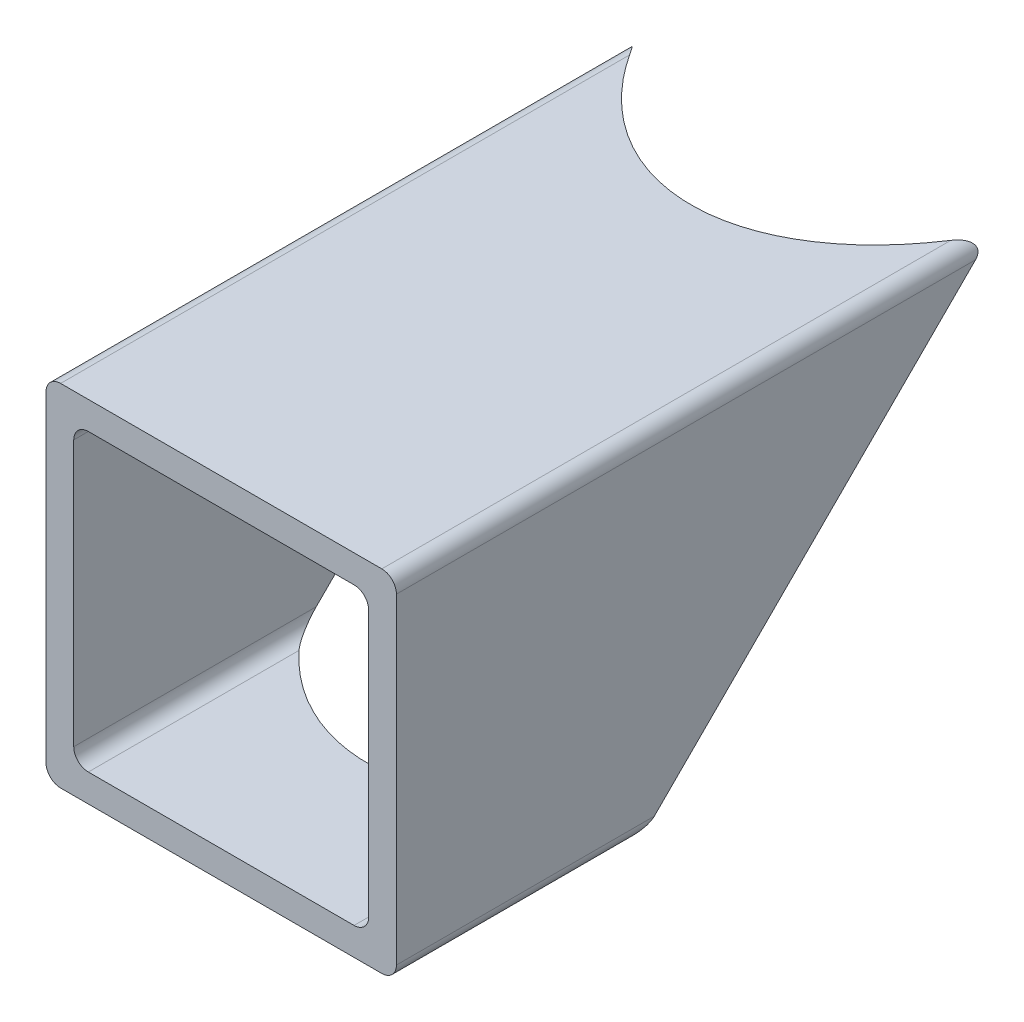
from build123d import *

# Parameters (mm, degrees)
BOSS_EXTRUDE1_DEPTH = 50.8
SKETCH3_R           = 19.05
CUT_EXTRUDE1_DEPTH  = 65.557986338


with BuildPart() as part:
    # Sketch2 → Boss-Extrude1 (new body)
    with BuildSketch(Plane.XY):
        with BuildLine():
            Line((-13.97, -15.24), (13.97, -15.24))
            ThreePointArc((13.97, -15.24), (14.868025612, -14.868025612), (15.24, -13.97))
            Line((15.24, -13.97), (15.24, 13.97))
            ThreePointArc((15.24, 13.97), (14.868025612, 14.868025612), (13.97, 15.24))
            Line((13.97, 15.24), (-13.97, 15.24))
            ThreePointArc((-13.97, 15.24), (-14.868025612, 14.868025612), (-15.24, 13.97))
            Line((-15.24, 13.97), (-15.24, -13.97))
            ThreePointArc((-15.24, -13.97), (-14.868025612, -14.868025612), (-13.97, -15.24))
        make_face()
        with BuildLine():
            Line((-11.557, -12.827), (11.557, -12.827))
            ThreePointArc((11.557, -12.827), (12.455025612, -12.455025612), (12.827, -11.557))
            Line((12.827, -11.557), (12.827, 11.557))
            ThreePointArc((12.827, 11.557), (12.455025612, 12.455025612), (11.557, 12.827))
            Line((11.557, 12.827), (-11.557, 12.827))
            ThreePointArc((-11.557, 12.827), (-12.455025612, 12.455025612), (-12.827, 11.557))
            Line((-12.827, 11.557), (-12.827, -11.557))
            ThreePointArc((-12.827, -11.557), (-12.455025612, -12.455025612), (-11.557, -12.827))
        make_face(mode=Mode.SUBTRACT)
    extrude(amount=BOSS_EXTRUDE1_DEPTH)

    # Sketch3 → Cut-Extrude1 (cut, through all)
    with BuildSketch(Plane(origin=(0, 7.62, -7.62), x_dir=(-1, 0, 0), z_dir=(0, 0.7071067811865464, -0.7071067811865488))):
        with Locations((0, -1.251307345)):
            Circle(SKETCH3_R)
    extrude(amount=-CUT_EXTRUDE1_DEPTH, mode=Mode.SUBTRACT)


solid = part.part
